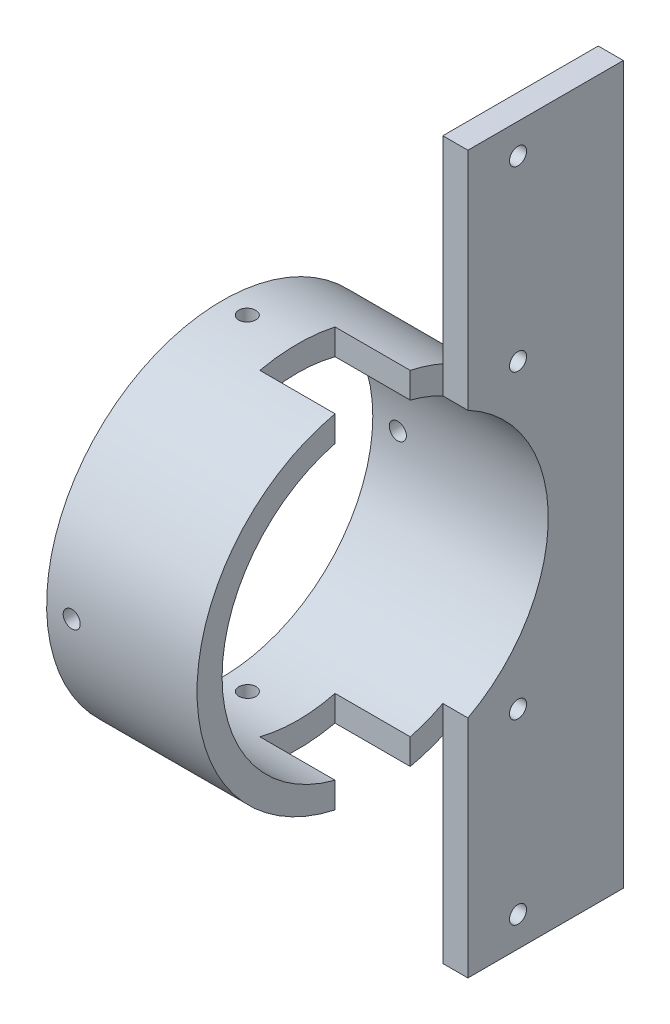
from build123d import *

# Parameters (mm, degrees)
SKETCH1_R            = 35.03125
SKETCH1_R_2          = 30.03125
BOSS_EXTRUDE1_DEPTH  = 30
M3_CLEARANCE_HOLE2_D = 3.4
M3_CLEARANCE_HOLE3_D = 3.4
BOSS_EXTRUDE2_DEPTH  = 5
M3_CLEARANCE_HOLE4_D = 3.4
SKETCH14_W           = 15
SKETCH14_H           = 123.928098147
CUT_EXTRUDE1_DEPTH   = 15


with BuildPart() as part:
    # Sketch1 → Boss-Extrude1 (new body)
    with BuildSketch(Plane(origin=(0, 0, 0), x_dir=(0, 0, -1), z_dir=(1, 0, 0))):
        Circle(SKETCH1_R)
        Circle(SKETCH1_R_2, mode=Mode.SUBTRACT)
    extrude(amount=BOSS_EXTRUDE1_DEPTH)

    # M3 Clearance Hole2 (through all)
    with Locations(Plane(origin=(0, 35.03125, 0), x_dir=(1, 0, 0), z_dir=(0, 1, 0))):
        with Locations((5, 0)):
            Hole(M3_CLEARANCE_HOLE2_D / 2)

    # M3 Clearance Hole3 (through all)
    with Locations(Plane.XY.offset(35.03125)):
        with Locations((5, 0)):
            Hole(M3_CLEARANCE_HOLE3_D / 2)

    # Sketch9 → Boss-Extrude2 (add)
    with BuildSketch(Plane(origin=(30, 0, 0), x_dir=(0, 0, -1), z_dir=(1, 0, 0))):
        with BuildLine():
            Line((14, 71.5), (45, 71.5))
            Line((45, 71.5), (45, -71.5))
            Line((45, -71.5), (14, -71.5))
            Line((14, -71.5), (14, -26.568326567))
            ThreePointArc((14, -26.568326567), (30.03125, 0), (14, 26.568326567))
            Line((14, 26.568326567), (14, 71.5))
        make_face()
    extrude(amount=BOSS_EXTRUDE2_DEPTH)

    # M3 Clearance Hole4 (through all)
    with Locations(Plane(origin=(35, 0, 0), x_dir=(0, 0, -1), z_dir=(1, 0, 0))):
        with Locations((24, 30.034163283), (24, 65.5), (24, -65.5), (24, -30.034163283)):
            Hole(M3_CLEARANCE_HOLE4_D / 2)

    # Sketch14 → Cut-Extrude1 (cut)
    with BuildSketch(Plane(origin=(30, 0, 0), x_dir=(0, 0, -1), z_dir=(1, 0, 0))):
        with Locations((0, 15.044796635)):
            Rectangle(SKETCH14_W, SKETCH14_H)
    extrude(amount=-CUT_EXTRUDE1_DEPTH, mode=Mode.SUBTRACT)


solid = part.part
